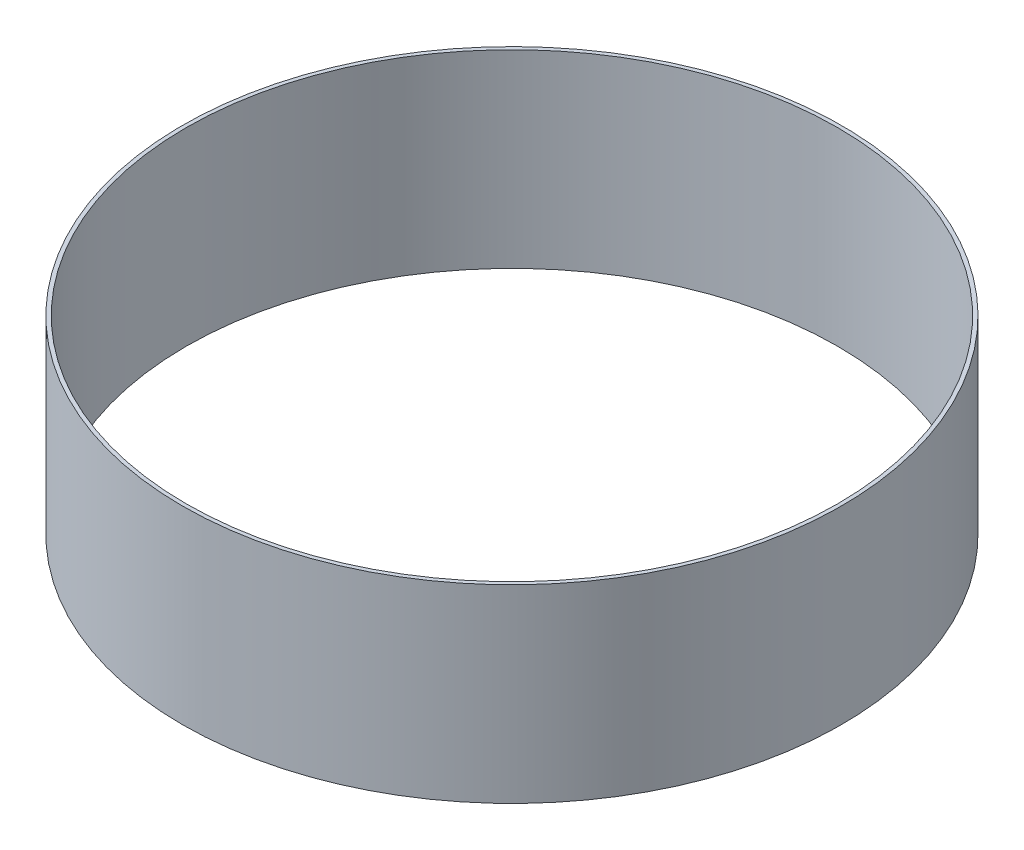
from build123d import *

# Parameters (mm, degrees)
SKETCH1_W = 1.524
SKETCH1_H = 76.2


with BuildPart() as part:
    # Sketch1 → Revolve1 (revolve)
    with BuildSketch(Plane.XY, mode=Mode.PRIVATE) as revolve1_sk:
        with Locations((131.826, 38.1)):
            Rectangle(SKETCH1_W, SKETCH1_H)
    revolve(revolve1_sk.sketch.rotate(Axis((0, 91.746766452, 0), (0, -1, 0)), 90), axis=Axis((0, 91.746766452, 0), (0, -1, 0)))


solid = part.part
